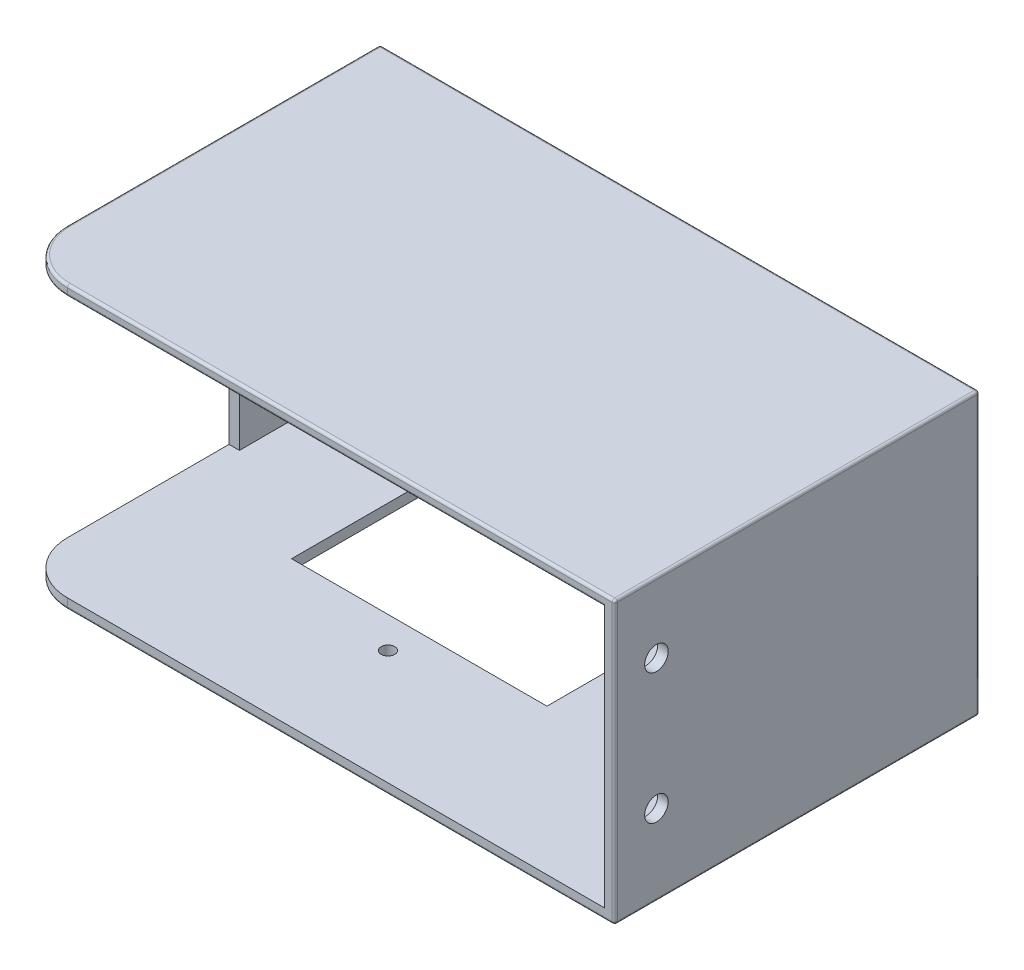
from build123d import *

# Parameters (mm, degrees)
CROQUIS1_W                          = 115
CROQUIS1_H                          = 70
SALIENTE_EXTRUIR1_DEPTH             = 54
CORTAR_EXTRUIR1_DEPTH               = 50
CROQUIS3_W                          = 49
CROQUIS3_H                          = 28
CORTAR_EXTRUIR2_DEPTH               = 105.452142151
CORTAR_EXTRUIR3_DEPTH               = 95.526451324
DI_METRO_DE_TALADRO_4_5_4_5_1_D     = 4.5
DI_METRO_DE_TALADRO_4_5_4_5_1_DEPTH = 115
DI_METRO_DE_TALADRO_2_6_2_6_1_D     = 2.6
DI_METRO_DE_TALADRO_2_6_2_6_1_DEPTH = 2
REDONDEO1_R                         = 10
REDONDEO2_R                         = 0.5


with BuildPart() as part:
    # Croquis1 → Saliente-Extruir1 (new body)
    with BuildSketch(Plane.XZ.offset(27)):
        with Locations((0, 35)):
            Rectangle(CROQUIS1_W, CROQUIS1_H)
    extrude(amount=-SALIENTE_EXTRUIR1_DEPTH)

    # Croquis2 → Cortar-Extruir1 (cut)
    with BuildSketch(Plane(origin=(0, 25, 0), x_dir=(1, 0, 0), z_dir=(0, 1, 0))):
        Polygon((-57.5, -29), (-57.5, -70), (55.5, -70), (55.5, -2), (-55.5, -2), (-55.5, -29), align=None)
    extrude(amount=-CORTAR_EXTRUIR1_DEPTH, mode=Mode.SUBTRACT)

    # Croquis3 → Cortar-Extruir2 (cut, through all)
    with BuildSketch(Plane(origin=(0, -25, 0), x_dir=(-1, 0, 0), z_dir=(0, 1, 0))):
        with Locations((8, 28)):
            Rectangle(CROQUIS3_W, CROQUIS3_H)
    extrude(amount=-CORTAR_EXTRUIR2_DEPTH, mode=Mode.SUBTRACT)

    # Croquis4 → Cortar-Extruir3 (cut, through all)
    with BuildSketch(Plane(origin=(0, 0, 0), x_dir=(-1, 0, 0), z_dir=(0, 0, -1))):
        with BuildLine():
            Line((-4.5, 15), (-16.5, 15))
            ThreePointArc((-16.5, 15), (-24.5, 7), (-16.5, -1))
            Line((-16.5, -1), (-4.5, -1))
            ThreePointArc((-4.5, -1), (3.5, 7), (-4.5, 15))
        make_face()
    extrude(amount=-CORTAR_EXTRUIR3_DEPTH, mode=Mode.SUBTRACT)

    # Diámetro de taladro Ø4.5 (4.5)1
    with Locations(Plane(origin=(57.5, 0, 0), x_dir=(0, 0, -1), z_dir=(1, 0, 0))):
        with Locations((-62, -11.5), (-62, 13.5)):
            Hole(DI_METRO_DE_TALADRO_4_5_4_5_1_D / 2, depth=DI_METRO_DE_TALADRO_4_5_4_5_1_DEPTH)

    # Diámetro de taladro Ø2.6 (2.6)1
    with Locations(Plane(origin=(0, -27, 0), x_dir=(-1, 0, 0), z_dir=(0, -1, 0))):
        with Locations((8, -48), (8, -8)):
            Hole(DI_METRO_DE_TALADRO_2_6_2_6_1_D / 2, depth=DI_METRO_DE_TALADRO_2_6_2_6_1_DEPTH)

    # Redondeo1
    redondeo1_edges = [part.edges().sort_by_distance(p)[0] for p in [
        (-57.5, -26, 70),
        (-57.5, 26, 70),
    ]]
    fillet(redondeo1_edges, radius=REDONDEO1_R)

    # Redondeo2
    redondeo2_edges = [part.edges().sort_by_distance(p)[0] for p in [
        (57.5, 27, 35),
        (5, 27, 70),
        (-57.5, 25, 44.5),
        (5, -27, 70),
        (57.5, -27, 35),
        (0, -27, 0),
        (57.5, 0, 70),
        (57.5, 0, 0),
        (-57.5, 0, 0),
        (0, 27, 0),
        (4, 25, 70),
        (-54.571067812, 25, 67.071067812),
        (-57.5, 27, 30),
        (-57.5, -27, 30),
        (-54.571067812, 27, 67.071067812),
        (-54.571067812, -27, 67.071067812),
    ]]
    fillet(redondeo2_edges, radius=REDONDEO2_R)


solid = part.part
